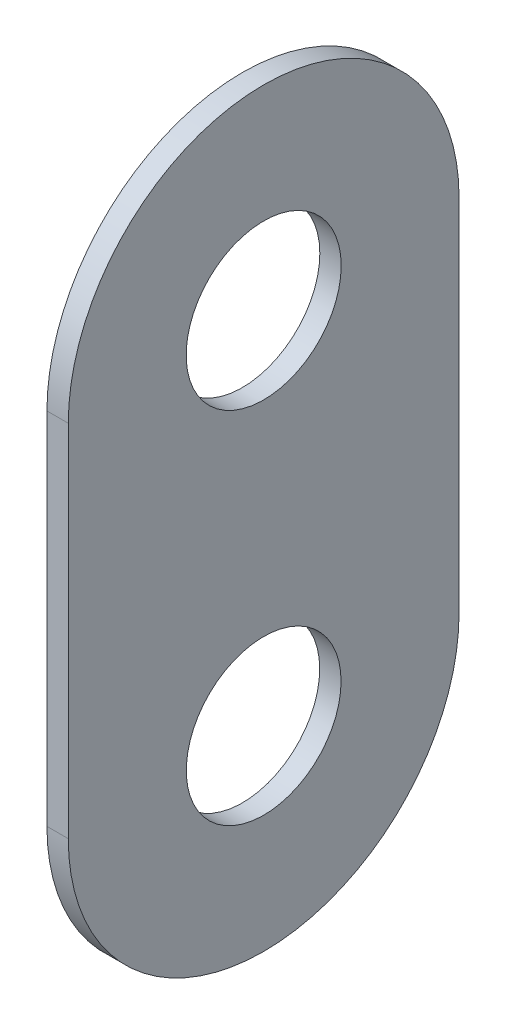
from build123d import *

# Parameters (mm, degrees)
SKETCH1_R           = 36.3
SKETCH1_R_2         = 36.241875
BOSS_EXTRUDE1_DEPTH = 10


with BuildPart() as part:
    # Sketch1 → Boss-Extrude1 (new body)
    with BuildSketch(Plane(origin=(0, 0, 0), x_dir=(0, 0, -1), z_dir=(1, 0, 0))):
        with BuildLine():
            Line((91.5, 82.3691), (91.5, -86.11315))
            ThreePointArc((91.5, -86.11315), (0, -177.61315), (-91.5, -86.11315))
            Line((-91.5, -86.11315), (-91.5, 82.3691))
            ThreePointArc((-91.5, 82.3691), (0, 173.8691), (91.5, 82.3691))
        make_face()
        with Locations((0, 82.3691)):
            Circle(SKETCH1_R, mode=Mode.SUBTRACT)
        with Locations((0, -86.11315)):
            Circle(SKETCH1_R_2, mode=Mode.SUBTRACT)
    extrude(amount=BOSS_EXTRUDE1_DEPTH)


solid = part.part
